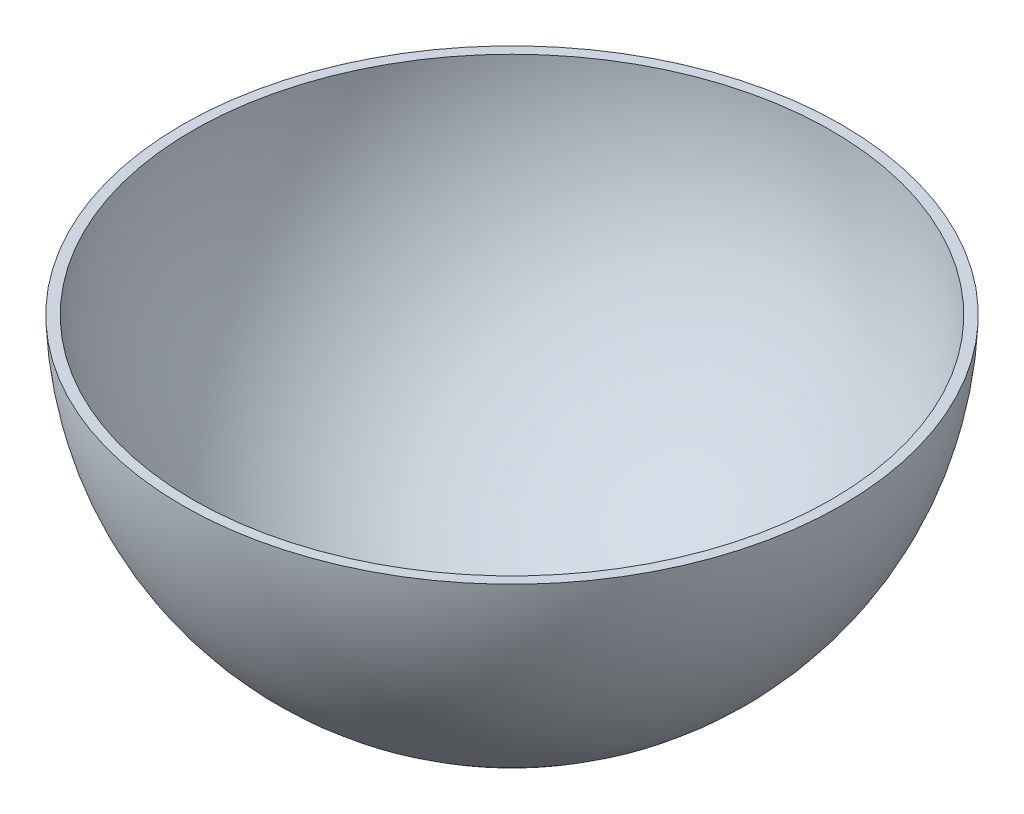
from build123d import *

# Parameters (mm, degrees)
SHELL1_T = -8


with BuildPart() as part:
    # Sketch1 → BowlRevolve (revolve)
    with BuildSketch(Plane.XY):
        with BuildLine():
            Line((0, 0), (258, 0))
            ThreePointArc((258, 0), (179.279692224, -176.596932507), (0, -248.999663003))
            Line((0, -248.999663003), (0, 0))
        make_face()
    revolve(axis=Axis((0, -248.999663003, 0), (0, 1, 0)))

    # Shell1
    shell1_openings = [part.faces().sort_by_distance(p)[0] for p in [
        (0, 0, 0),
    ]]
    offset(amount=SHELL1_T, openings=shell1_openings, kind=Kind.INTERSECTION)


solid = part.part
